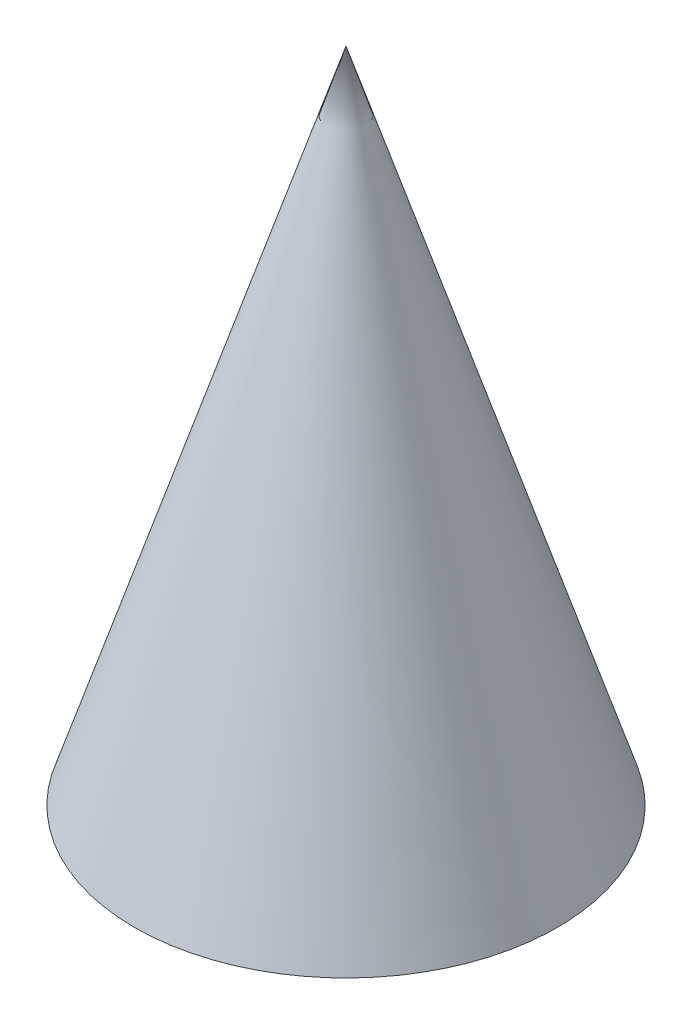
from build123d import *

# Parameters (mm, degrees)
SKETCH1_R = 24.511


with BuildPart() as part:
    # Sketch1 → Loft2 section 0
    with BuildSketch(Plane(origin=(0, 0, 0), x_dir=(1, 0, 0), z_dir=(0, 1, 0)), mode=Mode.PRIVATE) as loft2_s0:
        Circle(SKETCH1_R)
    loft([loft2_s0.sketch, Vertex(0, 76.2, 0)])


solid = part.part
